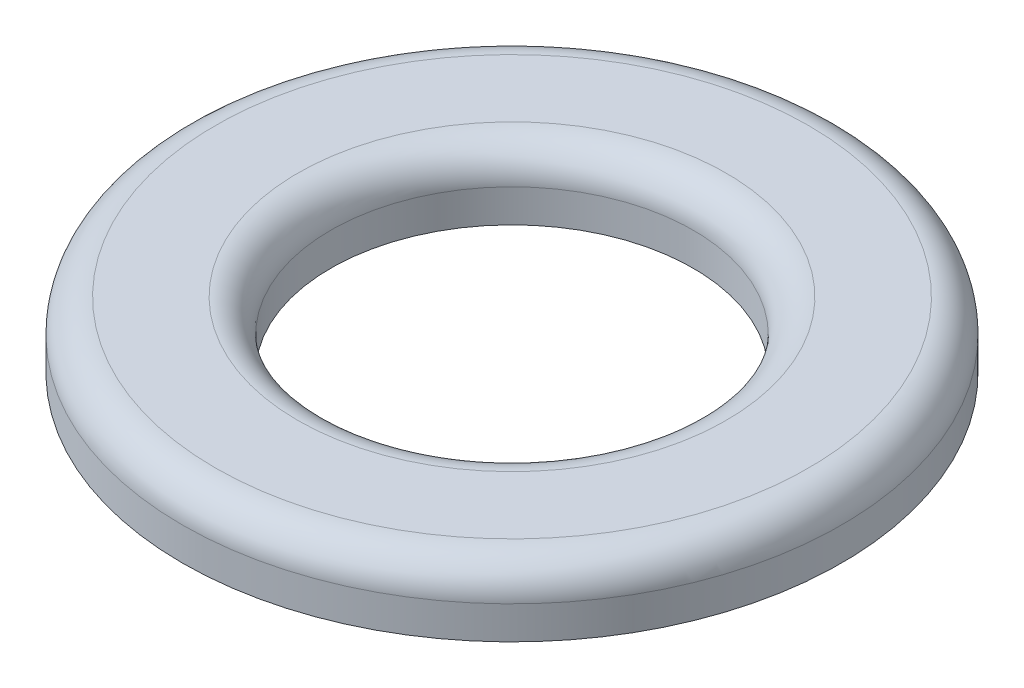
from build123d import *

# Parameters (mm, degrees)
SKETCH1_R           = 50
SKETCH1_R_2         = 27.5
BOSS_EXTRUDE1_DEPTH = 10
FILLET1_R           = 5
SKETCH2_R           = 43
SKETCH2_R_2         = 40
BOSS_EXTRUDE2_DEPTH = 3


with BuildPart() as part:
    # Sketch1 → Boss-Extrude1 (new body)
    with BuildSketch(Plane(origin=(0, 0, 0), x_dir=(1, 0, 0), z_dir=(0, 1, 0))):
        with Locations(Location((0, 0, 0), (0, 0, 270))):
            Circle(SKETCH1_R)
        with Locations(Location((0, 0, 0), (0, 0, 270))):
            Circle(SKETCH1_R_2, mode=Mode.SUBTRACT)
    extrude(amount=BOSS_EXTRUDE1_DEPTH)

    # Fillet1
    fillet1_edges = [part.edges().sort_by_distance(p)[0] for p in [
        (0, 10, -50),
        (0, 10, -27.5),
    ]]
    fillet(fillet1_edges, radius=FILLET1_R)

    # Sketch2 → Boss-Extrude2 (add)
    with BuildSketch(Plane.XZ):
        with Locations(Location((0, 0, 0), (0, 0, 270))):
            Circle(SKETCH2_R)
        with Locations(Location((0, 0, 0), (0, 0, 270))):
            Circle(SKETCH2_R_2, mode=Mode.SUBTRACT)
    extrude(amount=BOSS_EXTRUDE2_DEPTH)


solid = part.part
